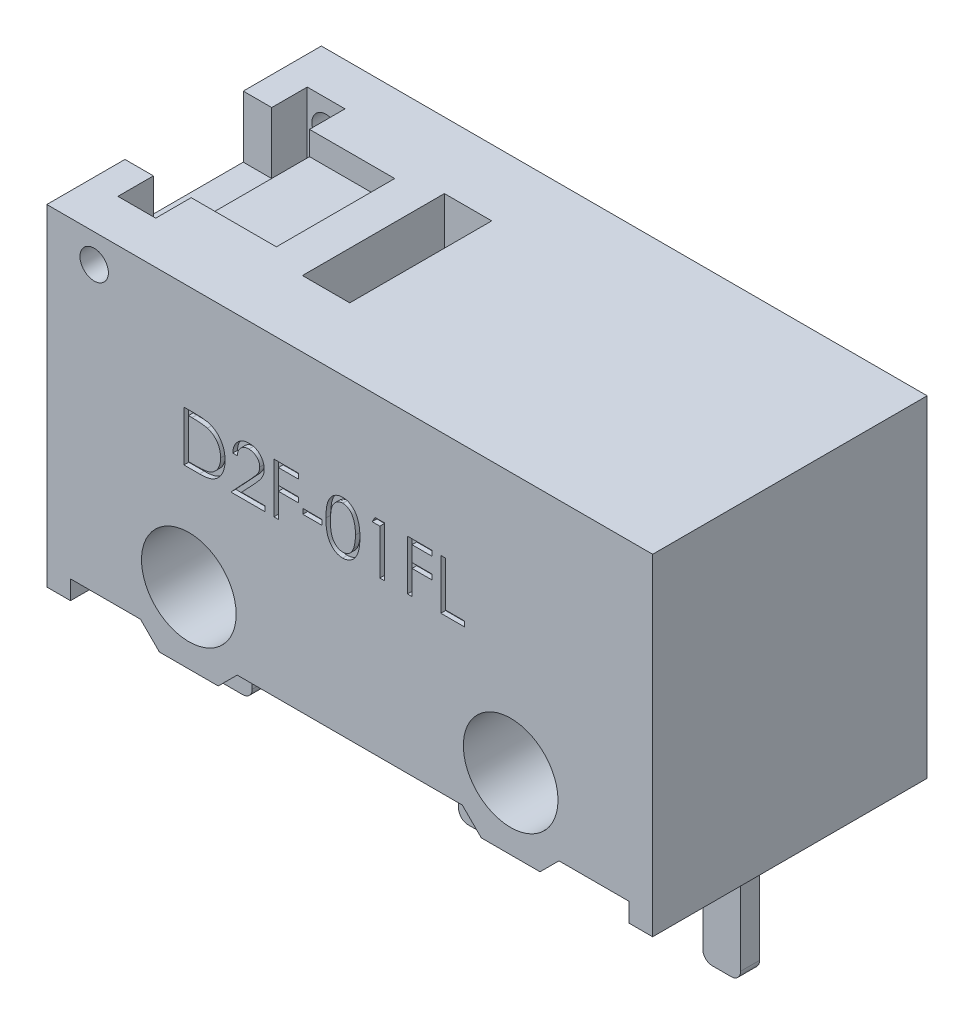
from build123d import *

# Parameters (mm, degrees)
SKETCH1_R           = 1
BOSS_EXTRUDE1_DEPTH = 5.8
CUT_EXTRUDE1_DEPTH  = 1.3
SKETCH3_W           = 1.8
SKETCH3_H           = 2.5
CUT_EXTRUDE2_DEPTH  = 0.5
SKETCH4_W           = 1
SKETCH4_H           = 3
CUT_EXTRUDE3_DEPTH  = 2
SKETCH5_R           = 0.3
CUT_EXTRUDE4_DEPTH  = 10.31933474
SKETCH6_W           = 0.8
SKETCH6_H           = 0.4
BOSS_EXTRUDE2_DEPTH = 3
FILLET1_R           = 0.2
SKETCH7_W           = 0.407051282
SKETCH7_H           = 0.108547008
CUT_EXTRUDE5_DEPTH  = 0.1


with BuildPart() as part:
    # Sketch1 → Boss-Extrude1 (new body)
    with BuildSketch(Plane.XY):
        Polygon((-2.778679656, -3.5), (-2.378679656, -3.1), (2.378679656, -3.1), (2.778679656, -3.5), (4.020507963, -3.5), (4.420507963, -3.1), (5.9, -3.1), (5.9, -3.5), (6.4, -3.5), (6.4, 3.5), (-6.4, 3.5), (-6.4, -3.5), (-5.9, -3.5), (-5.9, -3.1), (-4.421320344, -3.1), (-4.021320344, -3.5), align=None)
        with Locations((3.4, -2)):
            Circle(SKETCH1_R, mode=Mode.SUBTRACT)
        with Locations((-3.4, -2)):
            Circle(SKETCH1_R, mode=Mode.SUBTRACT)
    extrude(amount=BOSS_EXTRUDE1_DEPTH)

    # Sketch2 → Cut-Extrude1 (cut)
    with BuildSketch(Plane(origin=(0, 3.5, 0), x_dir=(1, 0, 0), z_dir=(0, 1, 0))):
        Polygon((-6.4, -1.65), (-5.798040001, -1.65), (-5.798040001, -0.9), (-5, -0.9), (-5, -4.9), (-5.798040001, -4.9), (-5.798040001, -4.15), (-6.4, -4.15), align=None)
    extrude(amount=-CUT_EXTRUDE1_DEPTH, mode=Mode.SUBTRACT)

    # Sketch3 → Cut-Extrude2 (cut)
    with BuildSketch(Plane(origin=(0, 3.5, 0), x_dir=(1, 0, 0), z_dir=(0, 1, 0))):
        with Locations((-4.1, -2.9)):
            Rectangle(SKETCH3_W, SKETCH3_H)
    extrude(amount=-CUT_EXTRUDE2_DEPTH, mode=Mode.SUBTRACT)

    # Sketch4 → Cut-Extrude3 (cut)
    with BuildSketch(Plane(origin=(0, 3.5, 0), x_dir=(1, 0, 0), z_dir=(0, 1, 0))):
        with Locations((-1.9, -2.9)):
            Rectangle(SKETCH4_W, SKETCH4_H)
    extrude(amount=-CUT_EXTRUDE3_DEPTH, mode=Mode.SUBTRACT)

    # Sketch5 → Cut-Extrude4 (cut, through all)
    with BuildSketch(Plane.XY.offset(5.8)):
        with Locations((-5.4, 2.9)):
            Circle(SKETCH5_R)
    extrude(amount=-CUT_EXTRUDE4_DEPTH, mode=Mode.SUBTRACT)

    # Sketch6 → Boss-Extrude2 (add)
    with BuildSketch(Plane.XZ.offset(3.1)):
        with Locations((0, 2.9)):
            Rectangle(SKETCH6_W, SKETCH6_H)
        with Locations((5.16, 2.9)):
            Rectangle(SKETCH6_W, SKETCH6_H)
        with Locations((-5.16, 2.9)):
            Rectangle(SKETCH6_W, SKETCH6_H)
    extrude(amount=BOSS_EXTRUDE2_DEPTH)

    # Fillet1
    fillet1_edges = [part.edges().sort_by_distance(p)[0] for p in [
        (0.4, -6.1, 2.9),
        (-0.4, -6.1, 2.9),
        (5.56, -6.1, 2.9),
        (4.76, -6.1, 2.9),
        (-4.76, -6.1, 2.9),
        (-5.56, -6.1, 2.9),
    ]]
    fillet(fillet1_edges, radius=FILLET1_R)

    # Sketch7 → Cut-Extrude5 (cut)
    # profile 1 of 8: a face of its own
    with BuildSketch(Plane.XY.offset(5.8)):
        with BuildLine():
            Line((-3.502368215, 0.183027557), (-3.502368215, 1.24136089))
            Line((-3.502368215, 1.24136089), (-3.288666292, 1.24136089))
            add(Edge.make_bspline(
                [(-3.288666292, 1.24136089), (-3.270079241, 1.241227066), (-3.234169155, 1.240968517), (-3.18227682, 1.239329192), (-3.134263634, 1.236429217), (-3.090287508, 1.232205099), (-3.050227713, 1.227018348), (-3.014196419, 1.220517035), (-2.982007319, 1.212840136), (-2.962210607, 1.206294964), (-2.952848985, 1.203199833)],
                knots=[0, 0, 0, 0, 1.314313732, 2.53924729, 3.670748893, 4.714932338, 5.66265055, 6.526160246, 7.303039223, 8, 8, 8, 8], degree=3))
            add(Edge.make_bspline(
                [(-2.952848985, 1.203199833), (-2.940604147, 1.198533881), (-2.916392143, 1.189307787), (-2.881918561, 1.171903857), (-2.849465416, 1.152184658), (-2.818858674, 1.130124194), (-2.790797472, 1.105097832), (-2.76418556, 1.078168666), (-2.740111584, 1.048357429), (-2.718065504, 1.016282373), (-2.698188293, 0.982321348), (-2.6809105, 0.946539065), (-2.666561316, 0.909117243), (-2.654649555, 0.870159948), (-2.645261698, 0.82958152), (-2.638856685, 0.787334708), (-2.634632124, 0.743586477), (-2.634207565, 0.713900389), (-2.633992147, 0.698837854)],
                knots=[0, 0, 0, 0, 0.984719456, 1.947108742, 2.898477687, 3.838006223, 4.779231079, 5.722358779, 6.681677486, 7.655904652, 8.64651281, 9.637519902, 10.640069247, 11.656948941, 12.698408672, 13.768548281, 14.867775369, 16, 16, 16, 16], degree=3))
            add(Edge.make_bspline(
                [(-2.633992147, 0.698837854), (-2.634182335, 0.685756479), (-2.63455712, 0.659978264), (-2.637922413, 0.621986851), (-2.642813824, 0.585122509), (-2.650386712, 0.549560785), (-2.659579853, 0.51499011), (-2.67136187, 0.481778931), (-2.684858794, 0.449622589), (-2.700597686, 0.418955876), (-2.717876153, 0.389902094), (-2.73641868, 0.36251378), (-2.75620549, 0.337181748), (-2.777425265, 0.313829287), (-2.799803788, 0.2924916), (-2.823487574, 0.272990443), (-2.848537735, 0.25570739), (-2.874842072, 0.239963288), (-2.903167949, 0.226229038), (-2.93405189, 0.214608535), (-2.967625603, 0.204978725), (-3.003806681, 0.196944192), (-3.042657637, 0.190570817), (-3.084216562, 0.186299265), (-3.128419605, 0.18341064), (-3.158772383, 0.183157731), (-3.174395125, 0.183027557)],
                knots=[0, 0, 0, 0, 1.105936401, 2.179363191, 3.223086493, 4.248585256, 5.251745608, 6.245858792, 7.225916811, 8.198733463, 9.158002045, 10.082870192, 10.993790845, 11.873723703, 12.748670949, 13.606408763, 14.465103618, 15.319838547, 16.196477973, 17.123216899, 18.106603292, 19.147568657, 20.255746949, 21.433717677, 22.679120308, 24, 24, 24, 24], degree=3))
            Line((-3.174395125, 0.183027557), (-3.502368215, 0.183027557))
        make_face()
        with BuildLine():
            Line((-3.407389583, 0.291574566), (-3.285910216, 0.291574566))
            add(Edge.make_bspline(
                [(-3.285910216, 0.291574566), (-3.268454256, 0.291649585), (-3.234880053, 0.291793875), (-3.186602516, 0.293060006), (-3.142491365, 0.295128878), (-3.102540337, 0.298024199), (-3.066771989, 0.301854947), (-3.035111569, 0.306126048), (-3.00766286, 0.311447182), (-2.991053245, 0.316270448), (-2.983377831, 0.318499312)],
                knots=[0, 0, 0, 0, 1.375205317, 2.645023457, 3.804390687, 4.853969522, 5.800190428, 6.637939096, 7.370582563, 8, 8, 8, 8], degree=3))
            add(Edge.make_bspline(
                [(-2.983377831, 0.318499312), (-2.973717255, 0.321901569), (-2.954626845, 0.32862482), (-2.927146136, 0.340888684), (-2.901517232, 0.355415691), (-2.877293486, 0.371563521), (-2.854818521, 0.389901717), (-2.833825991, 0.410031516), (-2.814358161, 0.432055365), (-2.796616168, 0.455945928), (-2.780738657, 0.481554509), (-2.766989023, 0.508629347), (-2.754938679, 0.536873787), (-2.745480628, 0.566721556), (-2.738067583, 0.597905819), (-2.732816832, 0.63042877), (-2.729546665, 0.664284333), (-2.729165227, 0.687311285), (-2.728970779, 0.699049859)],
                knots=[0, 0, 0, 0, 0.998632004, 1.973411704, 2.929992603, 3.868527914, 4.809262121, 5.754881198, 6.702106254, 7.672490631, 8.653608572, 9.636854334, 10.631411391, 11.644891563, 12.686317036, 13.754757253, 14.855430412, 16, 16, 16, 16], degree=3))
            add(Edge.make_bspline(
                [(-2.728970779, 0.699049859), (-2.729125988, 0.711427364), (-2.729430896, 0.735743082), (-2.733263366, 0.771421221), (-2.738863932, 0.805735608), (-2.746962808, 0.838688538), (-2.757283336, 0.870344302), (-2.770163144, 0.900527821), (-2.784879003, 0.929557864), (-2.802387869, 0.956764399), (-2.821563536, 0.982494934), (-2.842844467, 1.006067016), (-2.865892559, 1.02753434), (-2.89045643, 1.047231227), (-2.917228363, 1.064365243), (-2.945577693, 1.07969193), (-2.975920313, 1.092699117), (-2.997030342, 1.099617249), (-3.007758507, 1.103133059)],
                knots=[0, 0, 0, 0, 1.122418816, 2.205001699, 3.251619955, 4.274784885, 5.280384055, 6.268708349, 7.249350384, 8.229342522, 9.199999885, 10.157847722, 11.105861043, 12.055065948, 13.010012805, 13.98527497, 14.976112212, 16, 16, 16, 16], degree=3))
            add(Edge.make_bspline(
                [(-3.007758507, 1.103133059), (-3.016633734, 1.105587312), (-3.035504903, 1.110805728), (-3.066299217, 1.116498162), (-3.100956655, 1.121519046), (-3.139631089, 1.12576993), (-3.182278432, 1.128820144), (-3.228931486, 1.131109565), (-3.279610414, 1.132653713), (-3.314741799, 1.132759156), (-3.33297552, 1.132813882)],
                knots=[0, 0, 0, 0, 0.674548936, 1.434276114, 2.292660221, 3.240891867, 4.284742987, 5.42552168, 6.663806718, 8, 8, 8, 8], degree=3))
            Line((-3.33297552, 1.132813882), (-3.407389583, 1.132813882))
            Line((-3.407389583, 1.132813882), (-3.407389583, 0.291574566))
        make_face(mode=Mode.SUBTRACT)
    # profile 2 of 8: a face of its own
    with BuildSketch(Plane.XY.offset(5.8)):
        with BuildLine():
            Line((-2.376193002, 0.915719865), (-2.471171634, 0.915719865))
            add(Edge.make_bspline(
                [(-2.471171634, 0.915719865), (-2.470552614, 0.928320348), (-2.469336875, 0.95306736), (-2.463643559, 0.989148637), (-2.455497151, 1.023636635), (-2.443979021, 1.056254443), (-2.429674504, 1.087290463), (-2.412520424, 1.11662142), (-2.392202283, 1.144135422), (-2.369158819, 1.169577406), (-2.344131159, 1.192917457), (-2.317126744, 1.213072733), (-2.288749795, 1.230102124), (-2.259086405, 1.244338595), (-2.227801901, 1.255024691), (-2.19518018, 1.262953615), (-2.161077917, 1.267724082), (-2.137842958, 1.268236855), (-2.126026068, 1.268497643)],
                knots=[0, 0, 0, 0, 1.10065271, 2.161652631, 3.183658789, 4.190468796, 5.17591951, 6.163126047, 7.15150782, 8.156236427, 9.156009102, 10.134482811, 11.092018607, 12.041330605, 13.001268258, 13.972401359, 14.968799086, 16, 16, 16, 16], degree=3))
            add(Edge.make_bspline(
                [(-2.126026068, 1.268497643), (-2.114421269, 1.268225966), (-2.091618255, 1.267692133), (-2.058337598, 1.263107726), (-2.02665494, 1.255927512), (-1.99663221, 1.245853564), (-1.968508948, 1.232311606), (-1.942073885, 1.216044255), (-1.917012306, 1.197230164), (-1.894452636, 1.175079606), (-1.873737098, 1.151432694), (-1.855865701, 1.126187542), (-1.840561245, 1.100113449), (-1.827804494, 1.073011588), (-1.818413709, 1.044626777), (-1.811284108, 1.015372266), (-1.807254152, 0.984945239), (-1.806635655, 0.964351114), (-1.806321207, 0.953880923)],
                knots=[0, 0, 0, 0, 1.111607364, 2.184268762, 3.212621178, 4.221274766, 5.211760367, 6.196651075, 7.1921475, 8.207485113, 9.220403448, 10.201281604, 11.166441695, 12.114753415, 13.065576456, 14.026450734, 14.996634279, 16, 16, 16, 16], degree=3))
            add(Edge.make_bspline(
                [(-1.806321207, 0.953880923), (-1.806833217, 0.939140506), (-1.807848253, 0.909918346), (-1.816530934, 0.866975757), (-1.830091664, 0.825370127), (-1.846419437, 0.791885277), (-1.862890866, 0.764902768), (-1.877733993, 0.742687231), (-1.895110258, 0.718767244), (-1.915272565, 0.693222906), (-1.937803839, 0.665854133), (-1.962908159, 0.636677456), (-1.990764546, 0.605994326), (-2.010316045, 0.585037632), (-2.020447142, 0.574178398)],
                knots=[0, 0, 0, 0, 1.184426356, 2.348067706, 3.509069118, 4.696110526, 5.333549288, 6.050745305, 6.844228056, 7.710549037, 8.667450064, 9.695053472, 10.805634456, 12, 12, 12, 12], degree=3))
            Line((-2.020447142, 0.574178398), (-2.285242481, 0.291574566))
            Line((-2.285242481, 0.291574566), (-1.792752831, 0.291574566))
            Line((-1.792752831, 0.291574566), (-1.792752831, 0.183027557))
            Line((-1.792752831, 0.183027557), (-2.511876762, 0.183027557))
            Line((-2.511876762, 0.183027557), (-2.101433386, 0.621031697))
            add(Edge.make_bspline(
                [(-2.101433386, 0.621031697), (-2.091440335, 0.631463328), (-2.072245728, 0.651500356), (-2.045097187, 0.680753584), (-2.020713493, 0.707892136), (-1.998936805, 0.732864735), (-1.980239531, 0.756036661), (-1.963647213, 0.776657441), (-1.950352856, 0.795633191), (-1.935924629, 0.817628567), (-1.921950401, 0.84448372), (-1.909942141, 0.877302241), (-1.902620032, 0.911086434), (-1.901741665, 0.933916812), (-1.901299839, 0.945400687)],
                knots=[0, 0, 0, 0, 1.329631726, 2.553950428, 3.673215718, 4.687767853, 5.603093632, 6.413772471, 7.123043292, 7.734684054, 8.834405432, 9.900288307, 10.943827018, 12, 12, 12, 12], degree=3))
            add(Edge.make_bspline(
                [(-1.901299839, 0.945400687), (-1.901492076, 0.952621967), (-1.901870937, 0.966853724), (-1.905214574, 0.987719751), (-1.910267512, 1.007847683), (-1.917508102, 1.027299432), (-1.927065379, 1.045879426), (-1.938698996, 1.063610284), (-1.952121705, 1.080751947), (-1.967649351, 1.096824492), (-1.98470712, 1.111544761), (-2.002727286, 1.124584663), (-2.021792437, 1.135482204), (-2.041822188, 1.144415595), (-2.062760699, 1.151423388), (-2.084648467, 1.156279197), (-2.107425015, 1.159327948), (-2.122977524, 1.159740448), (-2.130902203, 1.159950634)],
                knots=[0, 0, 0, 0, 0.991446411, 1.95395049, 2.89581595, 3.838931463, 4.798493298, 5.75982156, 6.748411868, 7.785213223, 8.824556874, 9.840280684, 10.836137867, 11.835679398, 12.848801643, 13.863922112, 14.911575587, 16, 16, 16, 16], degree=3))
            add(Edge.make_bspline(
                [(-2.130902203, 1.159950634), (-2.139178622, 1.159734422), (-2.155432141, 1.159309817), (-2.179295753, 1.15633963), (-2.202060738, 1.151215531), (-2.223784361, 1.144207346), (-2.244503379, 1.135299642), (-2.26411703, 1.124204757), (-2.282581285, 1.110965463), (-2.299930853, 1.095955104), (-2.315915913, 1.079243235), (-2.329960564, 1.060613555), (-2.342232397, 1.040406218), (-2.352939474, 1.018675746), (-2.361634647, 0.995224961), (-2.368278909, 0.970137107), (-2.373536361, 0.943521118), (-2.375292747, 0.925140866), (-2.376193002, 0.915719865)],
                knots=[0, 0, 0, 0, 1.031018746, 2.02475058, 2.990194455, 3.934040569, 4.864654155, 5.795059489, 6.735614925, 7.690564532, 8.649604399, 9.611025574, 10.590972636, 11.591080095, 12.624614302, 13.701020113, 14.821632451, 16, 16, 16, 16], degree=3))
        make_face()
    # profile 3 of 8: a face of its own
    with BuildSketch(Plane.XY.offset(5.8)):
        Polygon((-1.602795566, 1.24136089), (-1.087197275, 1.24136089), (-1.087197275, 1.132813882), (-1.507816933, 1.132813882), (-1.507816933, 0.807172856), (-1.087197275, 0.807172856), (-1.087197275, 0.698625848), (-1.507816933, 0.698625848), (-1.507816933, 0.183027557), (-1.602795566, 0.183027557), align=None)
    # profile 4 of 8: a face of its own
    with BuildSketch(Plane.XY.offset(5.8)):
        with Locations((-0.788693002, 0.590078839)):
            Rectangle(SKETCH7_W, SKETCH7_H)
    # profile 5 of 8: a face of its own
    with BuildSketch(Plane.XY.offset(5.8)):
        with BuildLine():
            add(Edge.make_bspline(
                [(-0.503757104, 0.711770212), (-0.503657918, 0.728732994), (-0.503465247, 0.761683441), (-0.501321843, 0.809696892), (-0.497761204, 0.854739647), (-0.49288157, 0.896813859), (-0.486943419, 0.935930393), (-0.479016355, 0.971984712), (-0.470001531, 1.005143689), (-0.45955353, 1.035515451), (-0.447764365, 1.063509185), (-0.434933053, 1.08964252), (-0.420550365, 1.113875913), (-0.405438298, 1.13659615), (-0.388985124, 1.157431315), (-0.371659062, 1.176675644), (-0.352783875, 1.193884371), (-0.333001204, 1.209561705), (-0.312131939, 1.22330476), (-0.290770943, 1.235409897), (-0.268771185, 1.245751286), (-0.246072601, 1.253882441), (-0.222879208, 1.260598578), (-0.199109928, 1.265191427), (-0.174725516, 1.268081254), (-0.158266487, 1.268357529), (-0.149919297, 1.268497643)],
                knots=[0, 0, 0, 0, 1.646270934, 3.197905019, 4.663502075, 6.030701355, 7.308322542, 8.50163776, 9.611534131, 10.641858119, 11.616356847, 12.558055219, 13.465016945, 14.349605745, 15.204443733, 16.039544428, 16.859896111, 17.680448484, 18.487036065, 19.28249412, 20.06191084, 20.843045899, 21.620316918, 22.403196591, 23.190181807, 24, 24, 24, 24], degree=3))
            add(Edge.make_bspline(
                [(-0.149919297, 1.268497643), (-0.141502379, 1.268350137), (-0.124763776, 1.268056794), (-0.100016805, 1.265237411), (-0.075841544, 1.260559238), (-0.05234106, 1.253930753), (-0.029322314, 1.245707298), (-0.006965352, 1.235400003), (0.014868694, 1.22340187), (0.035832852, 1.209303697), (0.056157272, 1.193585247), (0.075342727, 1.175816535), (0.093390965, 1.156176977), (0.110528498, 1.134876699), (0.126269119, 1.111507162), (0.14125918, 1.086474824), (0.154676439, 1.059341919), (0.167598591, 1.030561159), (0.178752513, 0.999336195), (0.188811592, 0.965843042), (0.19693928, 0.929686085), (0.203709369, 0.89105503), (0.208954136, 0.849808005), (0.212774006, 0.806033429), (0.21479182, 0.759702501), (0.215171822, 0.728025723), (0.215366827, 0.711770212)],
                knots=[0, 0, 0, 0, 0.810914788, 1.612654377, 2.396697861, 3.181598691, 3.963628158, 4.749916497, 5.551656086, 6.361998678, 7.18212741, 8.025565596, 8.878627764, 9.750805457, 10.657531673, 11.591944965, 12.560506719, 13.57287815, 14.630710178, 15.753379473, 16.941251878, 18.199788006, 19.531962791, 20.947069417, 22.433333509, 24, 24, 24, 24], degree=3))
            add(Edge.make_bspline(
                [(0.215366827, 0.711770212), (0.215169801, 0.695585602), (0.214785902, 0.664050549), (0.212796626, 0.617928087), (0.208878183, 0.574385822), (0.203976591, 0.533319325), (0.197187848, 0.494899521), (0.188840571, 0.458993461), (0.179572498, 0.425446087), (0.168131977, 0.394532228), (0.155610166, 0.365820635), (0.141986333, 0.339009379), (0.127390457, 0.313861476), (0.111488623, 0.290578219), (0.094539138, 0.268994673), (0.076179235, 0.24949182), (0.056926463, 0.231599736), (0.036542233, 0.215678887), (0.015251121, 0.20174372), (-0.006507933, 0.189281436), (-0.029121004, 0.179232502), (-0.052075635, 0.170604049), (-0.075700165, 0.164012008), (-0.099965145, 0.159453961), (-0.12474715, 0.156257236), (-0.141499528, 0.156013371), (-0.149919297, 0.155890805)],
                knots=[0, 0, 0, 0, 1.561518951, 3.042555995, 4.452378317, 5.7783523, 7.031515105, 8.214008947, 9.334062868, 10.386615937, 11.391082383, 12.354592575, 13.286541444, 14.194233754, 15.072674879, 15.931287219, 16.775624067, 17.606195743, 18.42308326, 19.229000347, 20.022332153, 20.807536673, 21.593273796, 22.3848459, 23.188221202, 24, 24, 24, 24], degree=3))
            add(Edge.make_bspline(
                [(-0.149919297, 0.155890805), (-0.158266255, 0.156031822), (-0.174724828, 0.15630988), (-0.199112585, 0.159186651), (-0.222783705, 0.16381172), (-0.245854995, 0.170287693), (-0.268444822, 0.17821456), (-0.290245366, 0.188541984), (-0.311499023, 0.200435857), (-0.332149088, 0.213981139), (-0.351807527, 0.229499839), (-0.370584963, 0.246664278), (-0.388009671, 0.265902786), (-0.4042276, 0.286911587), (-0.419641193, 0.3094974), (-0.433819647, 0.333968599), (-0.446934167, 0.36022815), (-0.458921603, 0.388445709), (-0.46954989, 0.419033032), (-0.478938125, 0.452340046), (-0.486350739, 0.488660726), (-0.492695585, 0.527703359), (-0.497813197, 0.569635714), (-0.501307004, 0.614480556), (-0.503466402, 0.662209941), (-0.503658435, 0.694948658), (-0.503757104, 0.711770212)],
                knots=[0, 0, 0, 0, 0.810891512, 1.598919785, 2.382837074, 3.152667961, 3.926044502, 4.706494248, 5.493654104, 6.291793342, 7.103789334, 7.925228297, 8.761435821, 9.622817696, 10.50288917, 11.416980706, 12.369136599, 13.353924996, 14.394355917, 15.514179734, 16.714354668, 17.994756427, 19.357759367, 20.818452758, 22.365282078, 24, 24, 24, 24], degree=3))
        make_face()
        with BuildLine():
            add(Edge.make_bspline(
                [(-0.408778472, 0.712194224), (-0.408742353, 0.698058308), (-0.408672254, 0.67062327), (-0.406840975, 0.63075638), (-0.404346262, 0.593572494), (-0.401128536, 0.559024401), (-0.396350025, 0.52722904), (-0.39099583, 0.497967731), (-0.384480098, 0.471395329), (-0.37677089, 0.447329491), (-0.367990021, 0.425361796), (-0.358402771, 0.404920476), (-0.348103458, 0.385764058), (-0.336576953, 0.368064609), (-0.324023588, 0.351764412), (-0.310726912, 0.33657496), (-0.296190678, 0.323029206), (-0.276081213, 0.306783229), (-0.249533232, 0.2899953), (-0.216083713, 0.275376364), (-0.181712539, 0.266189288), (-0.15838347, 0.265020961), (-0.146739209, 0.264437814)],
                knots=[0, 0, 0, 0, 1.459021318, 2.831673884, 4.118529203, 5.306027144, 6.411944654, 7.436330062, 8.375795394, 9.233974572, 10.042671642, 10.816086306, 11.563610507, 12.285937304, 12.993564865, 13.685989202, 14.367179055, 15.041617293, 16.353048772, 17.594441528, 18.799311195, 20, 20, 20, 20], degree=3))
            add(Edge.make_bspline(
                [(-0.146739209, 0.264437814), (-0.135019627, 0.264920952), (-0.111604661, 0.265886231), (-0.077395156, 0.275199183), (-0.044184574, 0.289250687), (-0.018158059, 0.305865766), (0.001642615, 0.321688856), (0.015829419, 0.335179476), (0.028850562, 0.350285178), (0.041200428, 0.366583299), (0.052527339, 0.384385217), (0.062827383, 0.403605329), (0.072226395, 0.424297009), (0.077581273, 0.438741668), (0.080319084, 0.446126849)],
                knots=[0, 0, 0, 0, 1.353760809, 2.704726607, 4.075137775, 5.516104923, 6.260822281, 7.007110065, 7.778089737, 8.566572457, 9.372053459, 10.217411131, 11.088608312, 12, 12, 12, 12], degree=3))
            add(Edge.make_bspline(
                [(0.080319084, 0.446126849), (0.083509738, 0.455570128), (0.089988133, 0.474744033), (0.098337408, 0.504487327), (0.104912802, 0.535693877), (0.110828391, 0.568177187), (0.114866101, 0.60217681), (0.118116035, 0.63758755), (0.120030314, 0.674436105), (0.120267608, 0.699471733), (0.120388195, 0.712194224)],
                knots=[0, 0, 0, 0, 0.884706709, 1.796334032, 2.740027952, 3.714592787, 4.726048262, 5.777819803, 6.87074269, 8, 8, 8, 8], degree=3))
            add(Edge.make_bspline(
                [(0.120388195, 0.712194224), (0.120221828, 0.724914656), (0.119896379, 0.749798542), (0.118652388, 0.786240944), (0.115440021, 0.820853815), (0.111872192, 0.853786267), (0.106611604, 0.884856002), (0.100939601, 0.914323118), (0.093319234, 0.941822556), (0.085179207, 0.967784858), (0.07586273, 0.991915056), (0.065607258, 1.014325653), (0.054654488, 1.035124844), (0.042758144, 1.054255562), (0.030059449, 1.071803498), (0.016223238, 1.087416816), (0.001798344, 1.101579423), (-0.0184059, 1.117745485), (-0.044856459, 1.134228784), (-0.07776931, 1.149397954), (-0.112020195, 1.158109033), (-0.135174549, 1.15933721), (-0.146739209, 1.159950634)],
                knots=[0, 0, 0, 0, 1.31362396, 2.569729283, 3.763502607, 4.902122613, 5.988968491, 7.01645872, 7.998833611, 8.933434873, 9.825090667, 10.667526885, 11.477055099, 12.250526234, 12.991942729, 13.710640831, 14.402115721, 15.076753259, 16.378508321, 17.609869233, 18.806226677, 20, 20, 20, 20], degree=3))
            add(Edge.make_bspline(
                [(-0.146739209, 1.159950634), (-0.158444555, 1.159336363), (-0.18187657, 1.158106703), (-0.216483452, 1.149430409), (-0.249655958, 1.134307441), (-0.276036572, 1.11769089), (-0.296254908, 1.101864782), (-0.310491817, 1.088140783), (-0.323840779, 1.073128701), (-0.336137917, 1.056678598), (-0.34765539, 1.038999785), (-0.358232982, 1.019953182), (-0.367763222, 0.99944227), (-0.376557832, 0.977484443), (-0.384290556, 0.953420681), (-0.390668969, 0.926881009), (-0.396561483, 0.89771277), (-0.400732909, 0.865745205), (-0.404441235, 0.831188458), (-0.406824405, 0.793911746), (-0.40867838, 0.753977992), (-0.40874444, 0.726401104), (-0.408778472, 0.712194224)],
                knots=[0, 0, 0, 0, 1.207732386, 2.417664972, 3.655092373, 4.956220595, 5.625982001, 6.301752483, 6.994047911, 7.697131622, 8.419323945, 9.170223765, 9.943494443, 10.752040957, 11.610060368, 12.549350801, 13.567764191, 14.679664412, 15.874934091, 17.154273443, 18.533957287, 20, 20, 20, 20], degree=3))
        make_face(mode=Mode.SUBTRACT)
    # profile 6 of 8: a face of its own
    with BuildSketch(Plane.XY.offset(5.8)):
        Polygon((0.535283694, 1.24136089), (0.730965118, 1.24136089), (0.730965118, 0.183027557), (0.635986485, 0.183027557), (0.635986485, 1.132813882), (0.473165973, 1.132813882), align=None)
    # profile 7 of 8: a face of its own
    with BuildSketch(Plane.XY.offset(5.8)):
        Polygon((1.219426656, 1.24136089), (1.735024947, 1.24136089), (1.735024947, 1.132813882), (1.314405289, 1.132813882), (1.314405289, 0.807172856), (1.735024947, 0.807172856), (1.735024947, 0.698625848), (1.314405289, 0.698625848), (1.314405289, 0.183027557), (1.219426656, 0.183027557), align=None)
    # profile 8 of 8: a face of its own
    with BuildSketch(Plane.XY.offset(5.8)):
        Polygon((1.924982212, 1.24136089), (2.019960844, 1.24136089), (2.019960844, 0.291574566), (2.427012126, 0.291574566), (2.427012126, 0.183027557), (1.924982212, 0.183027557), align=None)
    extrude(amount=-CUT_EXTRUDE5_DEPTH, mode=Mode.SUBTRACT)


solid = part.part
